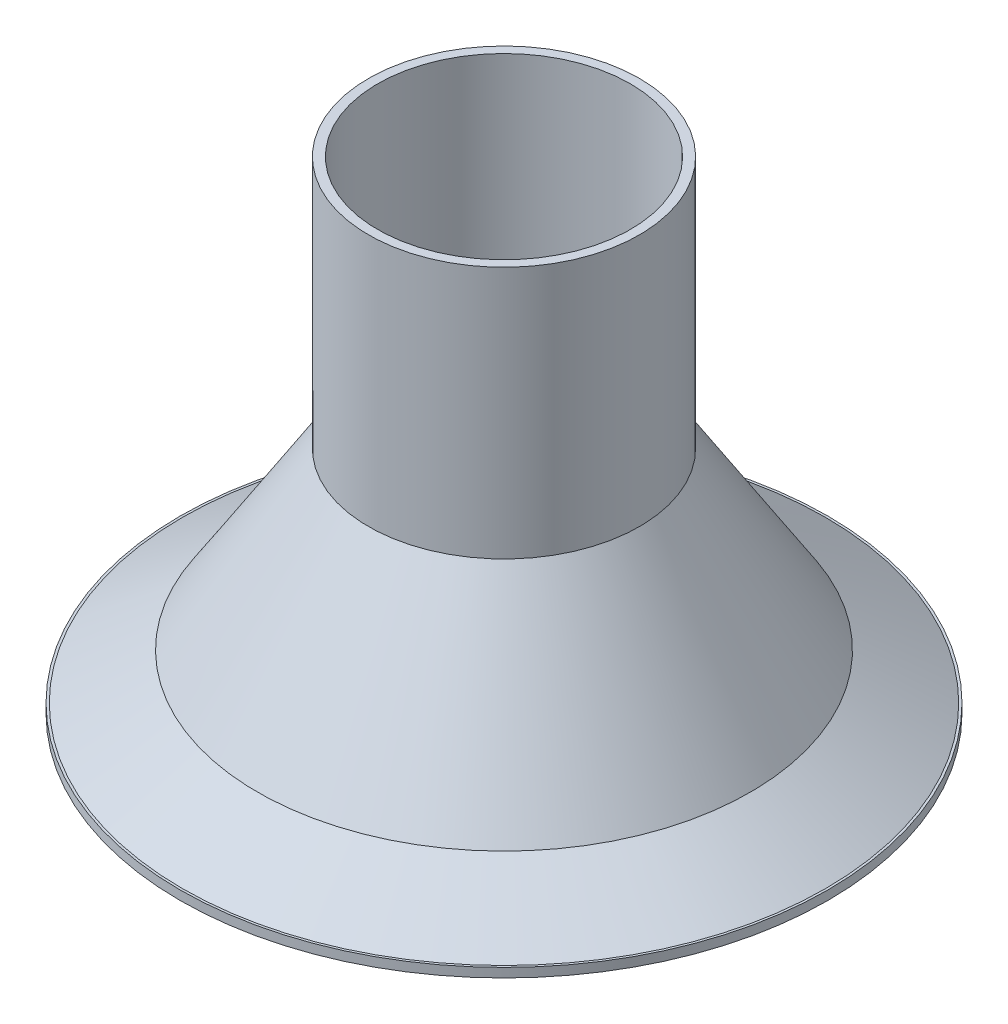
from build123d import *

# Parameters (mm, degrees)
SKETCH3_W = 0.8
SKETCH3_H = 0.8


with BuildPart() as part:
    # Sketch2 → Revolve2 (revolve)
    with BuildSketch(Plane.XY, mode=Mode.PRIVATE) as revolve2_sk:
        Polygon((-28, 1.8), (-21.458333333, 4.8), (-11.8, 20), (-11.8, 42), (-11, 42), (-11, 19.767332017), (-23.560492219, 0), (-29, 0), (-29, 0.8), (-28, 0.8), align=None)
    revolve(revolve2_sk.sketch.rotate(Axis((0, 0, 0), (0, 1, 0)), 270), axis=Axis((0, 0, 0), (0, 1, 0)))

    # Sketch3 → Cut-Revolve1 (revolve, cut)
    with BuildSketch(Plane.XY, mode=Mode.PRIVATE) as cut_revolve1_sk:
        with Locations((-28.6, 0.4)):
            Rectangle(SKETCH3_W, SKETCH3_H)
    revolve(cut_revolve1_sk.sketch.rotate(Axis((0, 0, 0), (0, 1, 0)), 270), axis=Axis((0, 0, 0), (0, 1, 0)), mode=Mode.SUBTRACT)

    # Sketch4 → Cut-Revolve2 (revolve, cut)
    with BuildSketch(Plane.XY, mode=Mode.PRIVATE) as cut_revolve2_sk:
        Polygon((-28, 0.8), (-28, 1.8), (-21.458333333, 4.8), align=None)
    revolve(cut_revolve2_sk.sketch.rotate(Axis((0, 0, 0), (0, 1, 0)), 270), axis=Axis((0, 0, 0), (0, 1, 0)), mode=Mode.SUBTRACT)


solid = part.part
